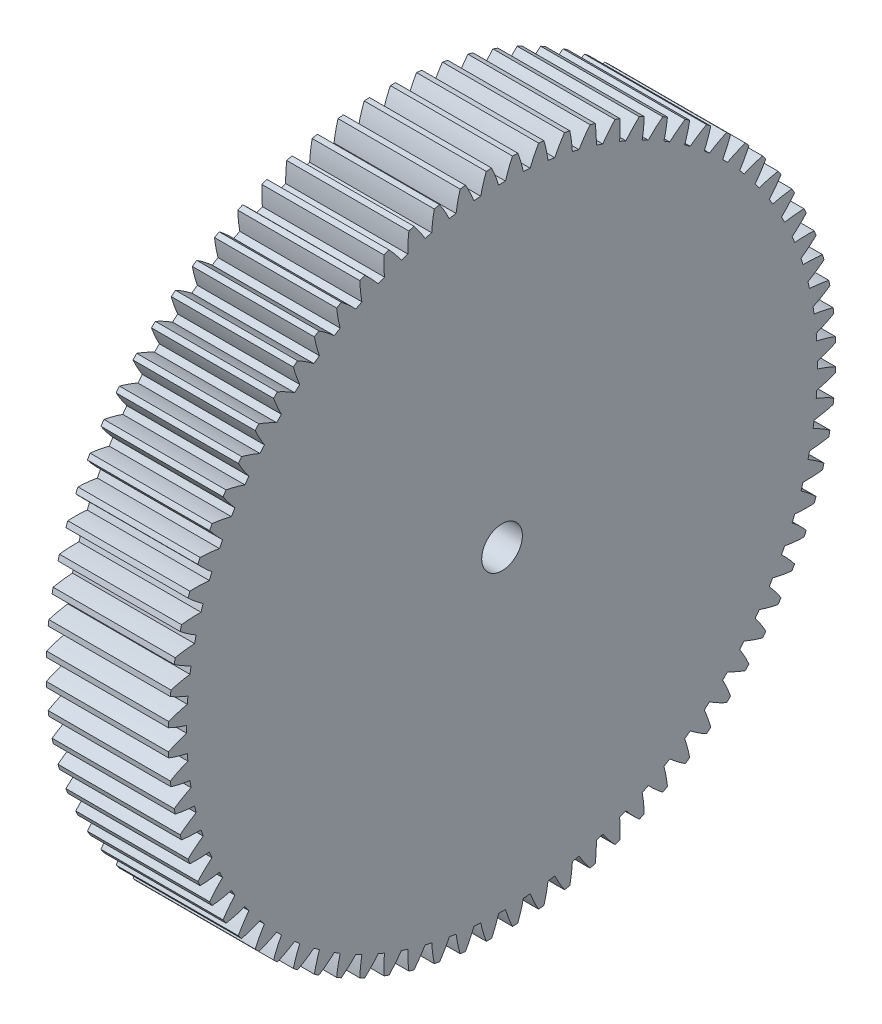
from build123d import *

# Parameters (mm, degrees)
BASPROSKE_W     = 12
BASPROSKE_H     = 32.8
TOOTHCUT_DEPTH  = 48.913254951
TEETHCUTS_COUNT = 80
TEETHCUTS_ANGLE = 355.5
BORSKE_R        = 2
BORE_DEPTH      = 50.0000508


with BuildPart() as part:
    # BasProSke → Base-Revolve (revolve)
    with BuildSketch(Plane(origin=(0, 0, 0), x_dir=(1, 0, 0), z_dir=(0, 1, 0)), mode=Mode.PRIVATE) as base_revolve_sk:
        with Locations((6, 16.4)):
            Rectangle(BASPROSKE_W, BASPROSKE_H)
    revolve(base_revolve_sk.sketch.rotate(Axis((-10, 0, 0), (1, 0, 0)), 180), axis=Axis((-10, 0, 0), (1, 0, 0)))

    # TooCutSke → ToothCut (cut, through all)
    with BuildSketch(Plane(origin=(0, 0, 0), x_dir=(0, 0, -1), z_dir=(1, 0, 0))):
        with BuildLine():
            ThreePointArc((0.335706178, 30.997182168), (0, 30.999), (-0.335706178, 30.997182168))
            ThreePointArc((-0.335706178, 30.997182168), (-0.651023397, 31.916413715), (-1.035171918, 32.809073505))
            ThreePointArc((-1.035171918, 32.809073505), (0, 32.8254), (1.035171918, 32.809073505))
            ThreePointArc((1.035171918, 32.809073505), (0.651023397, 31.916413715), (0.335706178, 30.997182168))
        make_face()
    toothcut = extrude(amount=TOOTHCUT_DEPTH, mode=Mode.SUBTRACT)

    # TeethCuts: ToothCut ×80 about axis
    teethcuts_axis = Axis((-10, 0, 0), (1, 0, 0))
    for i in range(1, TEETHCUTS_COUNT):
        add(toothcut.rotate(teethcuts_axis, i * TEETHCUTS_ANGLE / (TEETHCUTS_COUNT - 1)), mode=Mode.SUBTRACT)

    # BorSke → Bore (cut, symmetric)
    with BuildSketch(Plane(origin=(0, 0, 0), x_dir=(0, 0, -1), z_dir=(1, 0, 0))):
        with Locations(Location((0, 0, 0), (0, 0, 180))):
            Circle(BORSKE_R)
    extrude(amount=BORE_DEPTH, both=True, mode=Mode.SUBTRACT)


solid = part.part
